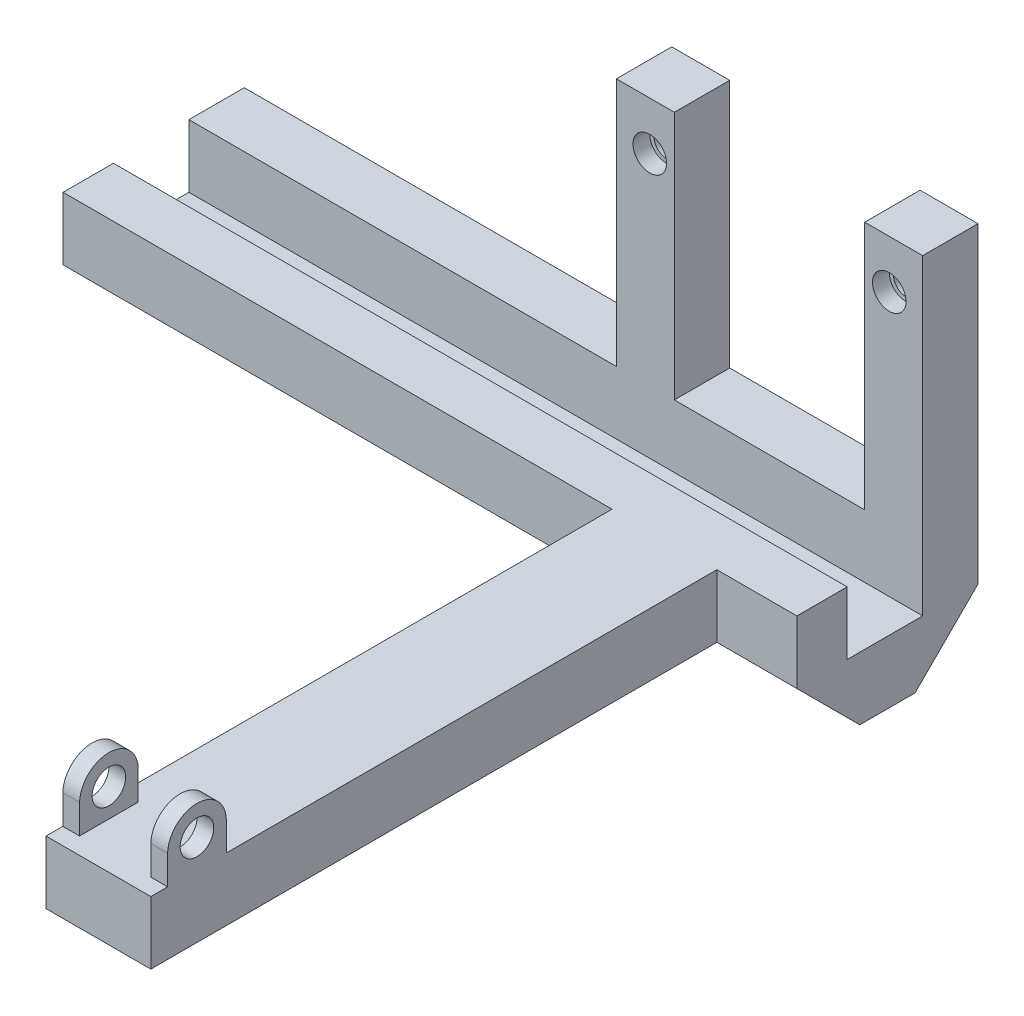
from build123d import *

# Parameters (mm, degrees)
BOSS_EXTRUDE1_DEPTH     = 15
SKETCH2_W               = 71.983860539
SKETCH2_H               = 7.5
BOSS_EXTRUDE2_DEPTH     = 15
SKETCH3_W               = 71.983860539
SKETCH3_H               = 7.5
BOSS_EXTRUDE3_DEPTH     = 7.5
SKETCH4_W               = 8.4
SKETCH4_H               = 26.56
CUT_EXTRUDE1_DEPTH      = 83.383916987
SKETCH5_W               = 71.983860539
SKETCH5_H               = 10
BOSS_EXTRUDE4_DEPTH     = 23.8
SKETCH6_W               = 61.591879109
SKETCH6_H               = 40.125144004
CUT_EXTRUDE2_DEPTH      = 1.984
ESQUISSE1_W             = 10.09
ESQUISSE1_H             = 11.56
ENL_V_MAT_EXTRU_1_DEPTH = 10
ESQUISSE2_W             = 4.91
ESQUISSE2_H             = 11.56
BOSS_EXTRU_1_DEPTH      = 6.6
ESQUISSE3_W             = 12.5
ESQUISSE3_H             = 15
BOSS_EXTRU_5_DEPTH      = 67.5
ESQUISSE4_W             = 22.7
ESQUISSE4_H             = 17.2
BOSS_EXTRU_6_DEPTH      = 5
ESQUISSE5_W             = 15
ESQUISSE5_H             = 11.56
ENL_V_MAT_EXTRU_4_DEPTH = 117.379654903
SKETCH7_W               = 1.5
SKETCH7_H               = 7.5
CUT_EXTRUDE3_DEPTH      = 123.929508563
BOSS_EXTRUDE5_REACH     = 137.469
SKETCH8_W               = 2
SKETCH8_H               = 15
SKETCH9_W               = 2
SKETCH9_H               = 15
CUT_EXTRUDE4_DEPTH      = 67.5
BOSS_EXTRUDE6_START     = -6.6
SKETCH10_W              = 2
SKETCH10_H              = 11.56
BOSS_EXTRUDE6_DEPTH     = 6.6
SKETCH12_W              = 2
SKETCH12_H              = 11.56
CUT_EXTRUDE6_DEPTH      = 112.407648191
SKETCH13_W              = 4
SKETCH13_H              = 11.56
BOSS_EXTRUDE7_DEPTH     = 6.6
SKETCH14_W              = 2
SKETCH14_H              = 17.2
CUT_EXTRUDE7_DEPTH      = 5
SKETCH15_W              = 2
SKETCH15_H              = 17.2
BOSS_EXTRUDE8_DEPTH     = 15
SKETCH16_W              = 40.389860539
SKETCH16_H              = 23.8
CUT_EXTRUDE8_DEPTH      = 122.16296495
SKETCH21_W              = 6.91
SKETCH21_H              = 23.8
CUT_EXTRUDE11_DEPTH     = 122.16296495
SKETCH22_W              = 22.7
SKETCH22_H              = 6.6
CUT_EXTRUDE12_DEPTH     = 122.16296495
SKETCH23_W              = 17.2
SKETCH23_H              = 7.5
CUT_EXTRUDE13_DEPTH     = 109.825660735
SKETCH26_R              = 1.05
CUT_EXTRUDE15_DEPTH     = 117.379654903
SKETCH27_R              = 1.05
CUT_EXTRUDE16_DEPTH     = 117.379654903
SKETCH28_W              = 67.5
SKETCH28_H              = 7.5
CUT_EXTRUDE17_DEPTH     = 112.85629988
CUT_EXTRUDE18_DEPTH     = 123.929508563
CUT_EXTRUDE19_DEPTH     = 123.929508563
SKETCH32_W              = 2
SKETCH32_H              = 7
BOSS_EXTRUDE10_DEPTH    = 10
SKETCH33_W              = 2
SKETCH33_H              = 7
BOSS_EXTRUDE11_DEPTH    = 10
CUT_EXTRUDE20_DEPTH     = 118.758559504
CUT_EXTRUDE21_DEPTH     = 118.758559504
SKETCH40_R              = 2
CUT_EXTRUDE22_DEPTH     = 118.758559504
BOSS_EXTRUDE12_DEPTH    = 17.5
SKETCH42_W              = 6.91
SKETCH42_H              = 6.6
BOSS_EXTRUDE13_DEPTH    = 18.14971438
SKETCH43_R              = 1.5
CUT_EXTRUDE23_DEPTH     = 124.158065892
SKETCH44_R              = 2
CUT_EXTRUDE24_DEPTH     = 2
SKETCH45_W              = 3.244883141
SKETCH45_H              = 3.430305034
SKETCH45_W_2            = 4.17199261
BOSS_EXTRUDE14_DEPTH    = 6.6
SKETCH46_W              = 22.7
SKETCH46_H              = 17.2
CUT_EXTRUDE25_DEPTH     = 135.332210295


with BuildPart() as part:
    # Sketch1 → Boss-Extrude1 (new body)
    with BuildSketch(Plane.XY):
        Polygon((0, 0), (0, -26.56), (-71.983860539, -26.56), (-71.983860539, -11.56), (-52.61, -11.56), (-52.61, 0), (-37.61, 0), (-37.61, -11.56), (-15, -11.56), (-15, 0), align=None)
    extrude(amount=BOSS_EXTRUDE1_DEPTH)

    # Sketch2 → Boss-Extrude2 (add)
    with BuildSketch(Plane.XY.offset(15)):
        with Locations((-35.99193027, -22.81)):
            Rectangle(SKETCH2_W, SKETCH2_H)
    extrude(amount=BOSS_EXTRUDE2_DEPTH)

    # Sketch3 → Boss-Extrude3 (add)
    with BuildSketch(Plane(origin=(0, -19.06, 0), x_dir=(1, 0, 0), z_dir=(0, 1, 0))):
        with Locations((-35.99193027, -26.25)):
            Rectangle(SKETCH3_W, SKETCH3_H)
    extrude(amount=BOSS_EXTRUDE3_DEPTH)

    # Sketch4 → Cut-Extrude1 (cut, through all)
    with BuildSketch(Plane(origin=(0, 0, 0), x_dir=(0, 0, -1), z_dir=(1, 0, 0))):
        with Locations((-4.2, -13.28)):
            Rectangle(SKETCH4_W, SKETCH4_H)
    extrude(amount=-CUT_EXTRUDE1_DEPTH, mode=Mode.SUBTRACT)

    # Sketch5 → Boss-Extrude4 (add)
    with BuildSketch(Plane(origin=(0, 0, 8.4), x_dir=(-1, 0, 0), z_dir=(0, 0, -1))):
        with Locations((35.99193027, -21.56)):
            Rectangle(SKETCH5_W, SKETCH5_H)
    extrude(amount=BOSS_EXTRUDE4_DEPTH)

    # Sketch6 → Cut-Extrude2 (cut)
    with BuildSketch(Plane.ZY.offset(71.983860539)):
        with Locations((3.866783639, -17.156311896)):
            Rectangle(SKETCH6_W, SKETCH6_H)
    extrude(amount=-CUT_EXTRUDE2_DEPTH, mode=Mode.SUBTRACT)

    # Esquisse1 → Enlèv. mat.-Extru.1 (cut)
    with BuildSketch(Plane.XY.offset(15)):
        with Locations((-9.955, -5.78)):
            Rectangle(ESQUISSE1_W, ESQUISSE1_H)
    extrude(amount=-ENL_V_MAT_EXTRU_1_DEPTH, mode=Mode.SUBTRACT)

    # Esquisse2 → Boss.-Extru.1 (add)
    with BuildSketch(Plane(origin=(0, 0, 8.4), x_dir=(-1, 0, 0), z_dir=(0, 0, -1))):
        with Locations((30.065, -5.78)):
            Rectangle(ESQUISSE2_W, ESQUISSE2_H)
    extrude(amount=-BOSS_EXTRU_1_DEPTH)

    # Esquisse3 → Boss.-Extru.5 (add)
    with BuildSketch(Plane.XY.offset(30)):
        with Locations((-13.79, -19.06)):
            Rectangle(ESQUISSE3_W, ESQUISSE3_H)
    extrude(amount=BOSS_EXTRU_5_DEPTH)

    # Esquisse4 → Boss.-Extru.6 (add)
    with BuildSketch(Plane(origin=(0, -16.56, 0), x_dir=(1, 0, 0), z_dir=(0, 1, 0))):
        with Locations((-16.26, 0.2)):
            Rectangle(ESQUISSE4_W, ESQUISSE4_H)
    extrude(amount=BOSS_EXTRU_6_DEPTH)

    # Esquisse5 → Enlèv. mat.-Extru.4 (cut, through all)
    with BuildSketch(Plane(origin=(0, 0, 8.4), x_dir=(-1, 0, 0), z_dir=(0, 0, -1))):
        with Locations((45.11, -5.78)):
            Rectangle(ESQUISSE5_W, ESQUISSE5_H)
    extrude(amount=-ENL_V_MAT_EXTRU_4_DEPTH, mode=Mode.SUBTRACT)

    # Sketch7 → Cut-Extrude3 (cut, through all)
    with BuildSketch(Plane(origin=(0, 0, 0), x_dir=(0, 0, -1), z_dir=(1, 0, 0))):
        with Locations((-23.25, -15.31)):
            Rectangle(SKETCH7_W, SKETCH7_H)
    extrude(amount=-CUT_EXTRUDE3_DEPTH, mode=Mode.SUBTRACT)

    # Sketch8 → Boss-Extrude5 (add, up to next)
    with BuildSketch(Plane.XY.offset(97.5), mode=Mode.PRIVATE) as boss_extrude5_sk1:
        with Locations((-21.04, -19.06)):
            Rectangle(SKETCH8_W, SKETCH8_H)
    boss_extrude5_tool1 = extrude(boss_extrude5_sk1.sketch, amount=-BOSS_EXTRUDE5_REACH, mode=Mode.PRIVATE) - part.part
    add(boss_extrude5_tool1.solids().sort_by_distance((-21.04, -19.06, 97.5))[0])

    # Sketch9 → Cut-Extrude4 (cut)
    with BuildSketch(Plane.XY.offset(97.5)):
        with Locations((-8.54, -19.06)):
            Rectangle(SKETCH9_W, SKETCH9_H)
    extrude(amount=-CUT_EXTRUDE4_DEPTH, mode=Mode.SUBTRACT)

    # Sketch10 → Boss-Extrude6 (add)
    with BuildSketch(Plane.XY.offset(15).offset(BOSS_EXTRUDE6_START)):
        with Locations((-5.91, -5.78)):
            Rectangle(SKETCH10_W, SKETCH10_H)
    extrude(amount=BOSS_EXTRUDE6_DEPTH)

    # Sketch12 → Cut-Extrude6 (cut, through all)
    with BuildSketch(Plane.XY.offset(15)):
        with Locations((-28.61, -5.78)):
            Rectangle(SKETCH12_W, SKETCH12_H)
    extrude(amount=-CUT_EXTRUDE6_DEPTH, mode=Mode.SUBTRACT)

    # Sketch13 → Boss-Extrude7 (add)
    with BuildSketch(Plane.XY.offset(15)):
        with Locations((-34.52, -5.78)):
            Rectangle(SKETCH13_W, SKETCH13_H)
    extrude(amount=-BOSS_EXTRUDE7_DEPTH)

    # Sketch14 → Cut-Extrude7 (cut)
    with BuildSketch(Plane(origin=(0, -11.56, 0), x_dir=(1, 0, 0), z_dir=(0, 1, 0))):
        with Locations((-5.91, 0.2)):
            Rectangle(SKETCH14_W, SKETCH14_H)
    extrude(amount=-CUT_EXTRUDE7_DEPTH, mode=Mode.SUBTRACT)

    # Sketch15 → Boss-Extrude8 (add)
    with BuildSketch(Plane(origin=(0, -11.56, 0), x_dir=(1, 0, 0), z_dir=(0, 1, 0))):
        with Locations((-28.61, 0.2)):
            Rectangle(SKETCH15_W, SKETCH15_H)
    extrude(amount=-BOSS_EXTRUDE8_DEPTH)

    # Sketch16 → Cut-Extrude8 (cut, through all)
    with BuildSketch(Plane(origin=(0, -16.56, 0), x_dir=(1, 0, 0), z_dir=(0, 1, 0))):
        with Locations((-49.80493027, 3.5)):
            Rectangle(SKETCH16_W, SKETCH16_H)
    extrude(amount=-CUT_EXTRUDE8_DEPTH, mode=Mode.SUBTRACT)

    # Sketch21 → Cut-Extrude11 (cut, through all)
    with BuildSketch(Plane(origin=(0, -16.56, 0), x_dir=(1, 0, 0), z_dir=(0, 1, 0))):
        with Locations((-3.455, 3.5)):
            Rectangle(SKETCH21_W, SKETCH21_H)
    extrude(amount=-CUT_EXTRUDE11_DEPTH, mode=Mode.SUBTRACT)

    # Sketch22 → Cut-Extrude12 (cut, through all)
    with BuildSketch(Plane(origin=(0, -16.56, 0), x_dir=(1, 0, 0), z_dir=(0, 1, 0))):
        with Locations((-18.26, 12.1)):
            Rectangle(SKETCH22_W, SKETCH22_H)
    extrude(amount=-CUT_EXTRUDE12_DEPTH, mode=Mode.SUBTRACT)

    # Sketch23 → Cut-Extrude13 (cut, through all)
    with BuildSketch(Plane.ZY.offset(29.61)):
        with Locations((-0.2, -22.81)):
            Rectangle(SKETCH23_W, SKETCH23_H)
    extrude(amount=-CUT_EXTRUDE13_DEPTH, mode=Mode.SUBTRACT)

    # Sketch26 → Cut-Extrude15 (cut, through all)
    with BuildSketch(Plane(origin=(0, 0, 8.4), x_dir=(-1, 0, 0), z_dir=(0, 0, -1))):
        with Locations(Location((3.98, -5.74, 0), (0, 0, 90))):
            Circle(SKETCH26_R)
    extrude(amount=-CUT_EXTRUDE15_DEPTH, mode=Mode.SUBTRACT)

    # Sketch27 → Cut-Extrude16 (cut, through all)
    with BuildSketch(Plane(origin=(0, 0, 8.4), x_dir=(-1, 0, 0), z_dir=(0, 0, -1))):
        with Locations(Location((32.54, -5.74, 0), (0, 0, 90))):
            Circle(SKETCH27_R)
    extrude(amount=-CUT_EXTRUDE16_DEPTH, mode=Mode.SUBTRACT)

    # Sketch28 → Cut-Extrude17 (cut, through all)
    with BuildSketch(Plane.ZY.offset(22.04)):
        with Locations((63.75, -22.81)):
            Rectangle(SKETCH28_W, SKETCH28_H)
    extrude(amount=-CUT_EXTRUDE17_DEPTH, mode=Mode.SUBTRACT)

    # Sketch29 → Cut-Extrude18 (cut, through all)
    with BuildSketch(Plane.ZY.offset(69.999860539)):
        Polygon((8.4, -19.06), (15.9, -26.56), (8.4, -26.56), align=None)
    extrude(amount=-CUT_EXTRUDE18_DEPTH, mode=Mode.SUBTRACT)

    # Sketch30 → Cut-Extrude19 (cut, through all)
    with BuildSketch(Plane.ZY.offset(69.999860539)):
        Polygon((30, -19.06), (22.5, -26.56), (30, -26.56), align=None)
    extrude(amount=-CUT_EXTRUDE19_DEPTH, mode=Mode.SUBTRACT)

    # Sketch32 → Boss-Extrude10 (add)
    with BuildSketch(Plane(origin=(0, -11.56, 0), x_dir=(1, 0, 0), z_dir=(0, 1, 0))):
        with Locations((-21.04, -92)):
            Rectangle(SKETCH32_W, SKETCH32_H)
    extrude(amount=BOSS_EXTRUDE10_DEPTH)

    # Sketch33 → Boss-Extrude11 (add)
    with BuildSketch(Plane(origin=(0, -11.56, 0), x_dir=(1, 0, 0), z_dir=(0, 1, 0))):
        with Locations((-10.54, -92)):
            Rectangle(SKETCH33_W, SKETCH33_H)
    extrude(amount=BOSS_EXTRUDE11_DEPTH)

    # Sketch37 → Cut-Extrude20 (cut, through all)
    with BuildSketch(Plane(origin=(-9.54, 0, 0), x_dir=(0, 0, -1), z_dir=(1, 0, 0))):
        with BuildLine():
            Line((-95.5, -1.56), (-95.5, -5.06))
            ThreePointArc((-95.5, -5.06), (-94.474873734, -2.585126266), (-92, -1.56))
            Line((-92, -1.56), (-95.5, -1.56))
        make_face()
        with BuildLine():
            ThreePointArc((-92, -1.56), (-89.525126266, -2.585126266), (-88.5, -5.06))
            Line((-88.5, -5.06), (-88.5, -1.56))
            Line((-88.5, -1.56), (-92, -1.56))
        make_face()
    extrude(amount=-CUT_EXTRUDE20_DEPTH, mode=Mode.SUBTRACT)

    # Sketch39 → Cut-Extrude21 (cut, through all)
    with BuildSketch(Plane(origin=(-9.54, 0, 0), x_dir=(0, 0, -1), z_dir=(1, 0, 0))):
        with BuildLine():
            ThreePointArc((-95.5, -8.077882472), (-92, -4.692017531), (-88.5, -8.077882472))
            Line((-88.5, -8.077882472), (-88.5, -5.06))
            ThreePointArc((-88.5, -5.06), (-92, -1.56), (-95.5, -5.06))
            Line((-95.5, -5.06), (-95.5, -8.077882472))
        make_face()
    extrude(amount=-CUT_EXTRUDE21_DEPTH, mode=Mode.SUBTRACT)

    # Sketch40 → Cut-Extrude22 (cut, through all)
    with BuildSketch(Plane(origin=(-9.54, 0, 0), x_dir=(0, 0, -1), z_dir=(1, 0, 0))):
        with Locations(Location((-92, -8.193941236, 0), (0, 0, 90))):
            Circle(SKETCH40_R)
    extrude(amount=-CUT_EXTRUDE22_DEPTH, mode=Mode.SUBTRACT)

    # Sketch41 → Boss-Extrude12 (add)
    with BuildSketch(Plane.ZY.offset(69.999860539)):
        Polygon((8.4, -11.56), (8.4, -19.06), (15.9, -26.56), (22.5, -26.56), (30, -19.06), (30, -11.56), (24, -11.56), (24, -19.06), (15, -19.06), (15, -11.56), align=None)
    extrude(amount=BOSS_EXTRUDE12_DEPTH)

    # Sketch42 → Boss-Extrude13 (add)
    with BuildSketch(Plane(origin=(0, 0, 0), x_dir=(1, 0, 0), z_dir=(0, 1, 0))):
        with Locations((-3.455, -11.7)):
            Rectangle(SKETCH42_W, SKETCH42_H)
        with Locations((-33.065, -11.7)):
            Rectangle(SKETCH42_W, SKETCH42_H)
    extrude(amount=BOSS_EXTRUDE13_DEPTH)

    # Sketch43 → Cut-Extrude23 (cut, through all)
    with BuildSketch(Plane.XY.offset(15)):
        with Locations((-32.54, 12.40971438)):
            Circle(SKETCH43_R)
        with Locations((-3.98, 12.40971438)):
            Circle(SKETCH43_R)
    extrude(amount=-CUT_EXTRUDE23_DEPTH, mode=Mode.SUBTRACT)

    # Sketch44 → Cut-Extrude24 (cut)
    with BuildSketch(Plane.XY.offset(15)):
        with Locations((-32.54, 12.40971438)):
            Circle(SKETCH44_R)
        with Locations((-3.98, 12.40971438)):
            Circle(SKETCH44_R)
    extrude(amount=-CUT_EXTRUDE24_DEPTH, mode=Mode.SUBTRACT)

    # Sketch45 → Boss-Extrude14 (add)
    with BuildSketch(Plane.XY.offset(15)):
        with Locations((-32.392839278, -5.503096066)):
            Rectangle(SKETCH45_W, SKETCH45_H)
        with Locations((-3.930578587, -5.503096066)):
            Rectangle(SKETCH45_W_2, SKETCH45_H)
    extrude(amount=-BOSS_EXTRUDE14_DEPTH)

    # Sketch46 → Cut-Extrude25 (cut, through all)
    with BuildSketch(Plane(origin=(0, -11.56, 0), x_dir=(1, 0, 0), z_dir=(0, 1, 0))):
        with Locations((-18.26, 0.2)):
            Rectangle(SKETCH46_W, SKETCH46_H)
    extrude(amount=-CUT_EXTRUDE25_DEPTH, mode=Mode.SUBTRACT)


solid = part.part
